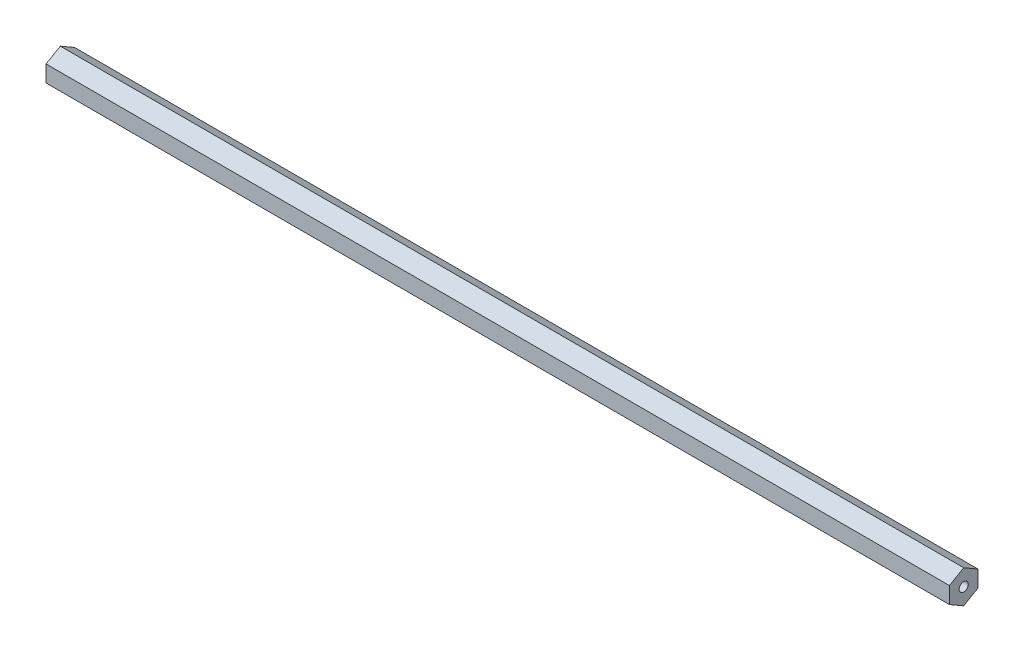
from build123d import *

# Parameters (mm, degrees)
BOSS_EXTRUDE1_DEPTH                  = 200.81875
F_10_32_TAPPED_HOLE1_D               = 4.0386
F_10_32_TAPPED_HOLE1_DEPTH           = 16.34744
F_10_32_TAPPED_HOLE1_TIP             = 1.213317848
F_10_32_TAPPED_HOLE1_ON_FACE_2_D     = 4.0386
F_10_32_TAPPED_HOLE1_ON_FACE_2_DEPTH = 16.34744
F_10_32_TAPPED_HOLE1_ON_FACE_2_TIP   = 1.213317848


with BuildPart() as part:
    # Sketch1 → Boss-Extrude1 (new, symmetric)
    with BuildSketch(Plane(origin=(0, 0, 0), x_dir=(0, 0, -1), z_dir=(1, 0, 0))):
        Polygon((0, 7.332348419), (-6.35, 3.666174209), (-6.35, -3.666174209), (0, -7.332348419), (6.35, -3.666174209), (6.35, 3.666174209), align=None)
    extrude(amount=BOSS_EXTRUDE1_DEPTH, both=True)

    # #10-32 Tapped Hole1
    with Locations(Plane(origin=(200.81875, 0, 0), x_dir=(0, 0, 1), z_dir=(1, 0, 0))):
        with Locations((0, 0)):
            Hole(F_10_32_TAPPED_HOLE1_D / 2, depth=F_10_32_TAPPED_HOLE1_DEPTH)
            with Locations((0, 0, -(F_10_32_TAPPED_HOLE1_DEPTH + F_10_32_TAPPED_HOLE1_TIP / 2))):  # 118° drill point
                Cone(0, F_10_32_TAPPED_HOLE1_D / 2, F_10_32_TAPPED_HOLE1_TIP, mode=Mode.SUBTRACT)

    # #10-32 Tapped Hole1 on face 2
    with Locations(Plane(origin=(-200.81875, 0, 0), x_dir=(0, 0, -1), z_dir=(-1, 0, 0))):
        with Locations((0, 0)):
            Hole(F_10_32_TAPPED_HOLE1_ON_FACE_2_D / 2, depth=F_10_32_TAPPED_HOLE1_ON_FACE_2_DEPTH)
            with Locations((0, 0, -(F_10_32_TAPPED_HOLE1_ON_FACE_2_DEPTH + F_10_32_TAPPED_HOLE1_ON_FACE_2_TIP / 2))):  # 118° drill point
                Cone(0, F_10_32_TAPPED_HOLE1_ON_FACE_2_D / 2, F_10_32_TAPPED_HOLE1_ON_FACE_2_TIP, mode=Mode.SUBTRACT)


solid = part.part
